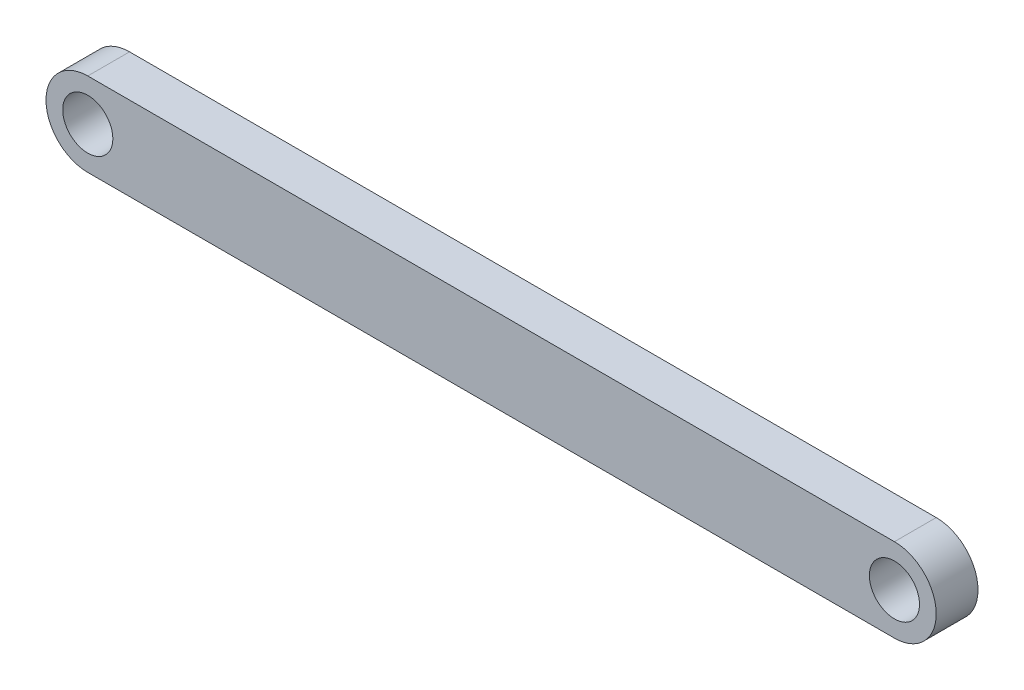
from build123d import *

# Parameters (mm, degrees)
ESBO_O1_R                = 3
RESSALTO_EXTRUS_O1_DEPTH = 5


with BuildPart() as part:
    # Esboço1 → Ressalto-extrusão1 (new body)
    with BuildSketch(Plane.XY):
        with BuildLine():
            Line((-48.27, 5), (48.27, 5))
            ThreePointArc((48.27, 5), (53.27, 0), (48.27, -5))
            Line((48.27, -5), (-48.27, -5))
            ThreePointArc((-48.27, -5), (-53.27, 0), (-48.27, 5))
        make_face()
        with Locations((-48.27, 0)):
            Circle(ESBO_O1_R, mode=Mode.SUBTRACT)
        with Locations((48.27, 0)):
            Circle(ESBO_O1_R, mode=Mode.SUBTRACT)
    extrude(amount=RESSALTO_EXTRUS_O1_DEPTH)


solid = part.part
